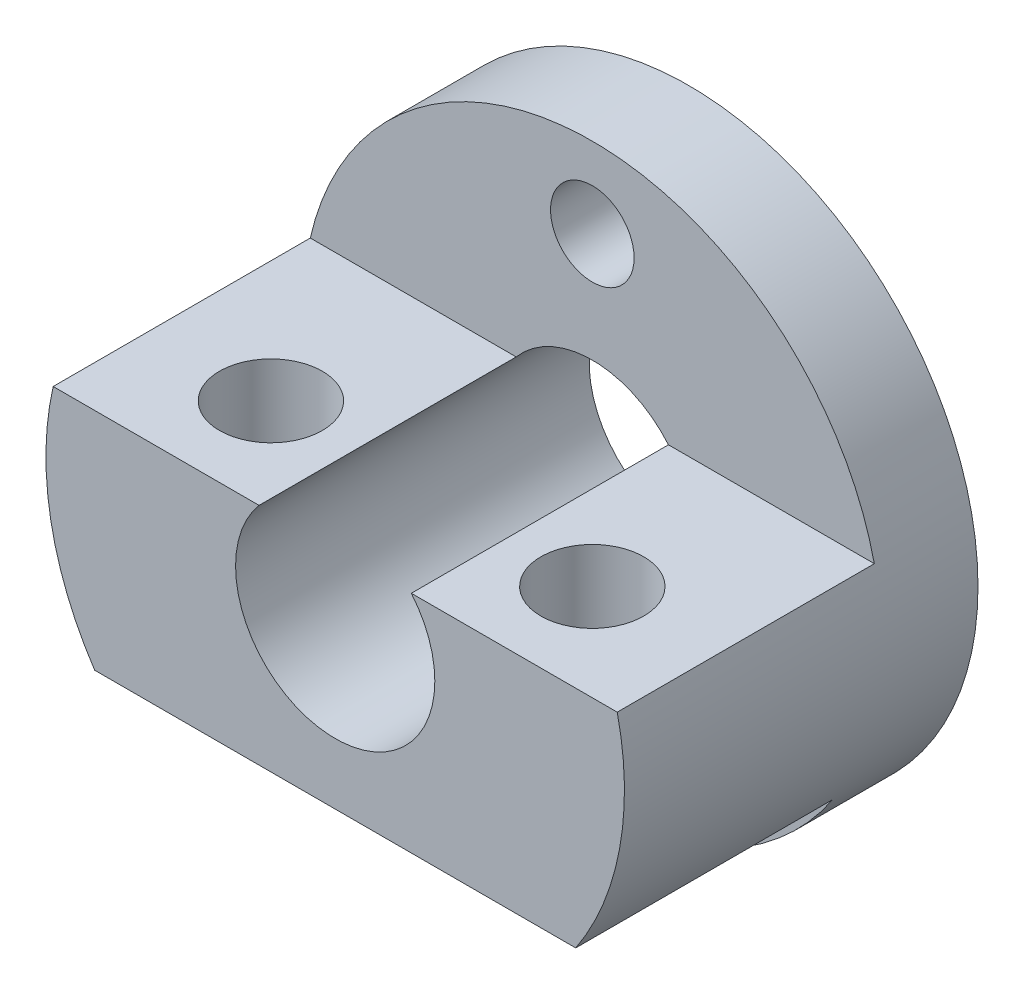
from build123d import *
from build123d.topology import SkipClean

# Parameters (mm, degrees)
SKETCH_1_R          = 9.5
EXTRUDE_1_DEPTH     = 3
SKETCH_3_R          = 9
EXTRUDE_2_DEPTH     = 13
CUT_EXTRUDE_START   = -13
CUT_EXTRUDE_2_DEPTH = 13
SKETCH_5_R          = 3.1
CUT_EXTRUDE_3_DEPTH = 20
SKETCH_6_R          = 1.6
CUT_EXTRUDE_4_DEPTH = 20
SKETCH_7_R          = 1.3
CUT_EXTRUDE_5_DEPTH = 20
CUT_EXTRUDE_START_2 = -5
SKETCH_8_R          = 9
CUT_EXTRUDE_6_DEPTH = 5
SKETCH_9_OUTSIDE_W  = 26.806
SKETCH_9_OUTSIDE_H  = 26.806
SKETCH_9_OUTSIDE_R  = 9
CUT_EXTRUDE_7_DEPTH = 13


with BuildPart() as part:
    # 草图1 → 凸台-拉伸1 (new body)
    with BuildSketch(Plane.XY):
        Circle(SKETCH_1_R)
    extrude(amount=EXTRUDE_1_DEPTH)

    # 草图3 → 凸台-拉伸2 (add)
    with BuildSketch(Plane.XY.offset(3)):
        with Locations(Location((0, 0, 0), (0, 0, 180))):
            Circle(SKETCH_3_R)
    extrude(amount=EXTRUDE_2_DEPTH)

    # 草图4 → 切除-拉伸2 (cut)
    with BuildSketch(Plane.XY.offset(16).offset(CUT_EXTRUDE_START)):
        with BuildLine():
            Line((-8.774964387, 2), (8.774964387, 2))
            ThreePointArc((8.774964387, 2), (0, 9), (-8.774964387, 2))
        make_face()
        with BuildLine():
            Line((-7.483314774, -5), (7.483314774, -5))
            ThreePointArc((7.483314774, -5), (0, -9), (-7.483314774, -5))
        make_face()
    extrude(amount=CUT_EXTRUDE_2_DEPTH, mode=Mode.SUBTRACT)

    # 草图5 → 切除-拉伸3 (cut)
    with BuildSketch(Plane.XY.offset(16)):
        Circle(SKETCH_5_R)
    extrude(amount=-CUT_EXTRUDE_3_DEPTH, mode=Mode.SUBTRACT)

    # 草图6 → 切除-拉伸4 (cut)
    with BuildSketch(Plane(origin=(0, 2, 0), x_dir=(1, 0, 0), z_dir=(0, 1, 0))):
        with Locations(Location((-5, -8, 0), (0, 0, 270))):
            Circle(SKETCH_6_R)
        with Locations(Location((5, -8, 0), (0, 0, 270))):
            Circle(SKETCH_6_R)
        with Locations(Location((0, -14, 0), (0, 0, 270))):
            Circle(SKETCH_6_R)
    extrude(amount=-CUT_EXTRUDE_4_DEPTH, mode=Mode.SUBTRACT)

    # 草图7 → 切除-拉伸5 (cut)
    with BuildSketch(Plane.XY.offset(3)):
        with Locations((0, 6.5)):
            Circle(SKETCH_7_R)
        with Locations((0, -6.5)):
            Circle(SKETCH_7_R)
    extrude(amount=-CUT_EXTRUDE_5_DEPTH, mode=Mode.SUBTRACT)

    # 草图8 → 切除-拉伸6 (cut)
    with BuildSketch(Plane.XY.offset(16).offset(CUT_EXTRUDE_START_2)):
        Circle(SKETCH_8_R)
    extrude(amount=CUT_EXTRUDE_6_DEPTH, mode=Mode.SUBTRACT)

    # 草图9 outside → 切除-拉伸7 (cut)
    with SkipClean():  # the faces are left unmerged after this step: merging them gives an invalid solid
        with BuildSketch(Plane.XY.offset(3)):
            Rectangle(SKETCH_9_OUTSIDE_W, SKETCH_9_OUTSIDE_H)
            with Locations(Location((0, 0, 0), (0, 0, 167.160411593))):
                Circle(SKETCH_9_OUTSIDE_R, mode=Mode.SUBTRACT)
        extrude(amount=-CUT_EXTRUDE_7_DEPTH, mode=Mode.SUBTRACT)


solid = part.part
